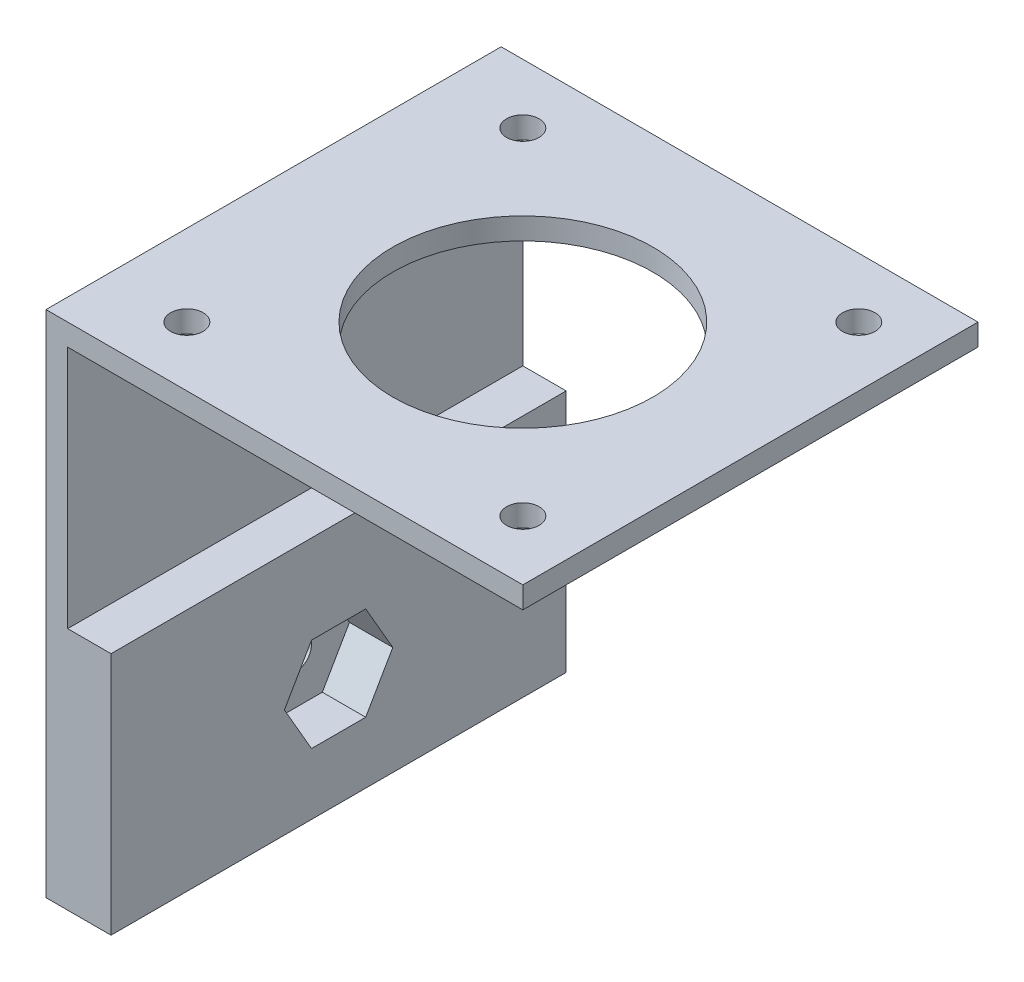
from build123d import *

# Parameters (mm, degrees)
SKETCH_1_W          = 42
SKETCH_1_H          = 42
EXTRUDE_1_DEPTH     = 2
SKETCH_2_R          = 12
SKETCH_2_R_2        = 1.5
CUT_EXTRUDE_1_DEPTH = 2
SKETCH_3_W          = 42
SKETCH_3_H          = 2
EXTRUDE_3_DEPTH     = 2
SKETCH_4_W          = 2
SKETCH_4_H          = 42
EXTRUDE_4_DEPTH     = 45
EXTRUDE_5_DEPTH     = 4
CUT_EXTRUDE_2_DEPTH = 4
CUT_EXTRUDE_3_DEPTH = 4


with BuildPart() as part:
    # 草图1 → 凸台-拉伸1 (new body)
    with BuildSketch(Plane(origin=(0, 0, 0), x_dir=(1, 0, 0), z_dir=(0, 1, 0))):
        with Locations((21, 21)):
            Rectangle(SKETCH_1_W, SKETCH_1_H)
    extrude(amount=EXTRUDE_1_DEPTH)

    # 草图2 → 切除-拉伸1 (cut)
    with BuildSketch(Plane(origin=(0, 2, 0), x_dir=(1, 0, 0), z_dir=(0, 1, 0))):
        with Locations(Location((21, 21, 0), (0, 0, 270))):
            Circle(SKETCH_2_R)
        with Locations(Location((36.5, 36.5, 0), (0, 0, 270))):
            Circle(SKETCH_2_R_2)
        with Locations(Location((36.5, 5.5, 0), (0, 0, 270))):
            Circle(SKETCH_2_R_2)
        with Locations(Location((5.5, 5.5, 0), (0, 0, 270))):
            Circle(SKETCH_2_R_2)
        with Locations(Location((5.5, 36.5, 0), (0, 0, 270))):
            Circle(SKETCH_2_R_2)
    extrude(amount=-CUT_EXTRUDE_1_DEPTH, mode=Mode.SUBTRACT)

    # 草图3 → 凸台-拉伸3 (add)
    with BuildSketch(Plane.ZY):
        with Locations((-21, 1)):
            Rectangle(SKETCH_3_W, SKETCH_3_H)
    extrude(amount=EXTRUDE_3_DEPTH)

    # 草图4 → 凸台-拉伸4 (add)
    with BuildSketch(Plane.XZ):
        with Locations((-1, -21)):
            Rectangle(SKETCH_4_W, SKETCH_4_H)
    extrude(amount=EXTRUDE_4_DEPTH)

    # 草图5 → 凸台-拉伸5 (add)
    with BuildSketch(Plane(origin=(0, 0, 0), x_dir=(0, 0, -1), z_dir=(1, 0, 0))):
        Polygon((0, -22.5), (0, -45), (42, -45), (42, -22.5), (21, -22.5), align=None)
    extrude(amount=EXTRUDE_5_DEPTH)

    # 草图6 → 切除-拉伸2 (cut)
    with BuildSketch(Plane(origin=(4, 0, 0), x_dir=(0, 0, -1), z_dir=(1, 0, 0))):
        Polygon((26, -35), (23.5, -30.669872981), (18.5, -30.669872981), (16, -35), (18.5, -39.330127019), (23.5, -39.330127019), align=None)
    extrude(amount=-CUT_EXTRUDE_2_DEPTH, mode=Mode.SUBTRACT)

    # 草图7 → 切除-拉伸3 (cut)
    with BuildSketch(Plane(origin=(0, 0, 0), x_dir=(0, 0, -1), z_dir=(1, 0, 0))):
        with BuildLine():
            ThreePointArc((22.5, -35), (21, -33.5), (19.5, -35))
            Line((19.5, -35), (22.5, -35))
        make_face()
        with BuildLine():
            Line((22.5, -35), (19.5, -35))
            ThreePointArc((19.5, -35), (21, -36.5), (22.5, -35))
        make_face()
    extrude(amount=-CUT_EXTRUDE_3_DEPTH, mode=Mode.SUBTRACT)


solid = part.part
